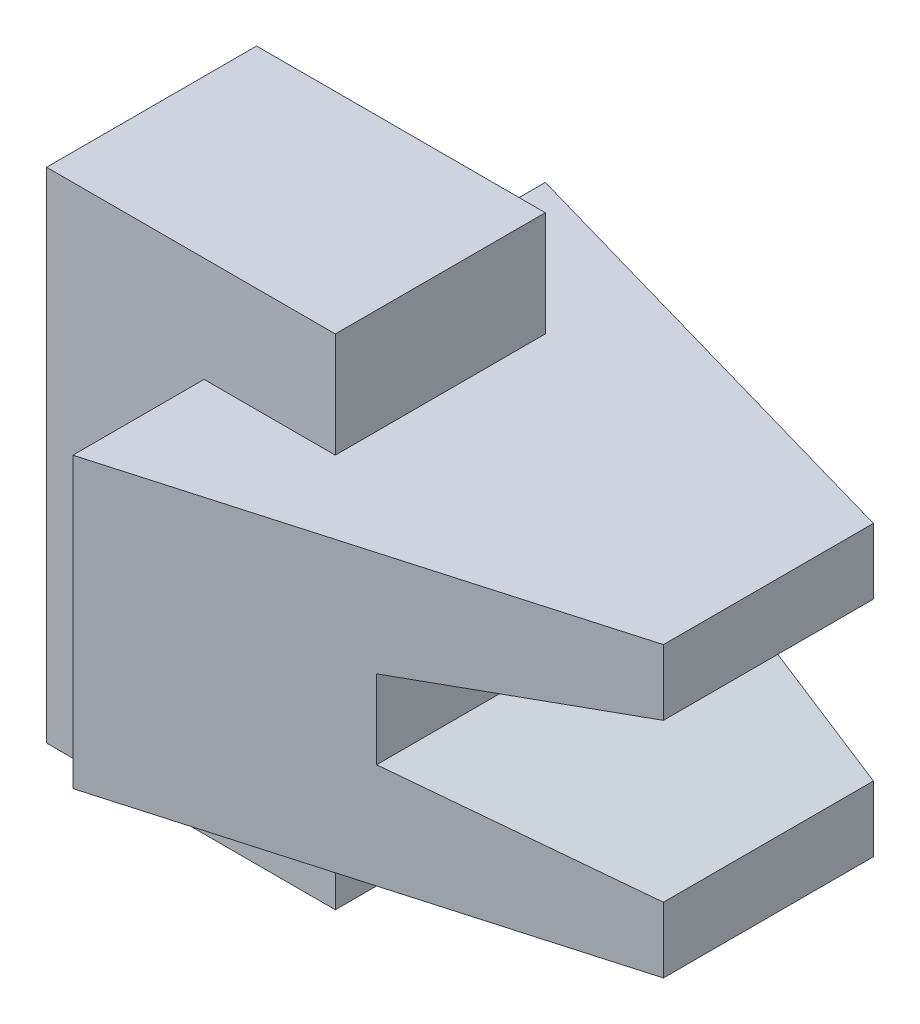
from build123d import *

# Parameters (mm, degrees)
BOSS_EXTRUDE1_DEPTH      = 22
CUT_EXTRUDE1_DEPTH       = 40.705228033
CUT_EXTRUDE1_DEPTH_BACK  = 40.705228033
BOSS_EXTRUDE2_DEPTH      = 8
BOSS_EXTRUDE2_DEPTH_BACK = 8


with BuildPart() as part:
    # Sketch1 → Boss-Extrude1 (new body)
    with BuildSketch(Plane(origin=(0, 0, 0), x_dir=(1, 0, 0), z_dir=(0, 1, 0))):
        Polygon((-27.721925134, 18), (-27.721925134, -18), (7.278074866, -8), (7.278074866, 8), align=None)
    extrude(amount=BOSS_EXTRUDE1_DEPTH)

    # Sketch2 → Cut-Extrude1 (cut, two sides: drawn at the far end of the back side and taken through both)
    with BuildSketch(Plane.XY.offset(-CUT_EXTRUDE1_DEPTH_BACK)):
        Polygon((-9.721925134, 14), (-9.721925134, 8), (7.278074866, 5), (7.278074866, 17), align=None)
    extrude(amount=CUT_EXTRUDE1_DEPTH + CUT_EXTRUDE1_DEPTH_BACK, mode=Mode.SUBTRACT)

    # Sketch3 → Boss-Extrude2 (add, two sides: drawn at the far end of the back side and taken through both)
    with BuildSketch(Plane.XY.offset(-BOSS_EXTRUDE2_DEPTH_BACK)):
        Polygon((-39.721925134, 30), (-39.721925134, -8), (-17.721925134, -8), (-17.721925134, 0), (-27.721925134, 0), (-27.721925134, 22), (-17.721925134, 22), (-17.721925134, 30), align=None)
    extrude(amount=BOSS_EXTRUDE2_DEPTH + BOSS_EXTRUDE2_DEPTH_BACK)


solid = part.part
